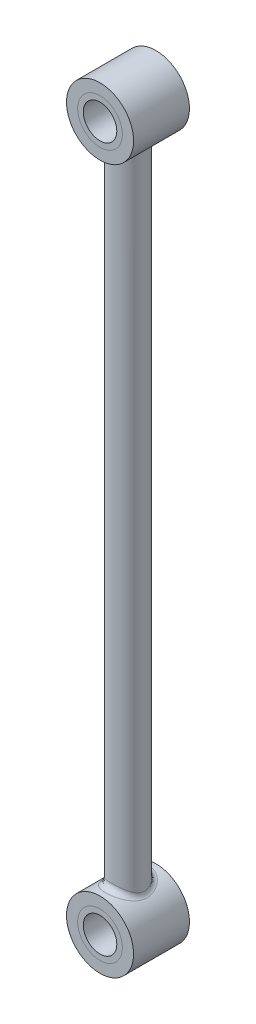
from build123d import *

# Parameters (mm, degrees)
SKETCH1_R             = 3
BOSS_EXTRUDE1_DEPTH   = 58
SKETCH2_R             = 6
SKETCH2_R_2           = 4
BOSS_EXTRUDE2_DEPTH   = 5
SKETCH3_R             = 4
SKETCH3_R_2           = 3
BOSS_EXTRUDE3_DEPTH   = 5
BOSS_EXTRUDE3_2_DEPTH = 5
FILLET1_R             = 1


with BuildPart() as part:
    # Sketch1 → Boss-Extrude1 (new, symmetric)
    with BuildSketch(Plane(origin=(0, 0, 0), x_dir=(1, 0, 0), z_dir=(0, 1, 0))):
        with Locations(Location((0, 0, 0), (0, 0, 90))):
            Circle(SKETCH1_R)
    extrude(amount=BOSS_EXTRUDE1_DEPTH, both=True)

    # Sketch2 → Boss-Extrude2 (add, symmetric)
    # profile 1 of 2: a face of its own
    with BuildSketch(Plane.XY):
        with Locations((0, -63)):
            Circle(SKETCH2_R)
        with Locations((0, -63)):
            Circle(SKETCH2_R_2, mode=Mode.SUBTRACT)
    # profile 2 of 2: a face of its own
    with BuildSketch(Plane.XY):
        with Locations((0, 63)):
            Circle(SKETCH2_R)
        with Locations((0, 63)):
            Circle(SKETCH2_R_2, mode=Mode.SUBTRACT)
    extrude(amount=BOSS_EXTRUDE2_DEPTH, both=True)

    # Fillet1
    fillet1_edges = [part.edges().sort_by_distance(p)[0] for p in [
        (0, -57, 3.000000001),
    ]]
    fillet(fillet1_edges, radius=FILLET1_R)


with BuildPart() as body_2:
    # Sketch3 → Boss-Extrude3 (new, symmetric)
    with BuildSketch(Plane.XY):
        with Locations((0, -63)):
            Circle(SKETCH3_R)
        with Locations((0, -63)):
            Circle(SKETCH3_R_2, mode=Mode.SUBTRACT)
    extrude(amount=BOSS_EXTRUDE3_DEPTH, both=True)


with BuildPart() as body_3:
    # Sketch3 → Boss-Extrude3 2 (new, symmetric)
    with BuildSketch(Plane.XY):
        with Locations((0, 63)):
            Circle(SKETCH3_R)
        with Locations((0, 63)):
            Circle(SKETCH3_R_2, mode=Mode.SUBTRACT)
    extrude(amount=BOSS_EXTRUDE3_2_DEPTH, both=True)


solid = Compound([part.part, body_2.part, body_3.part])
